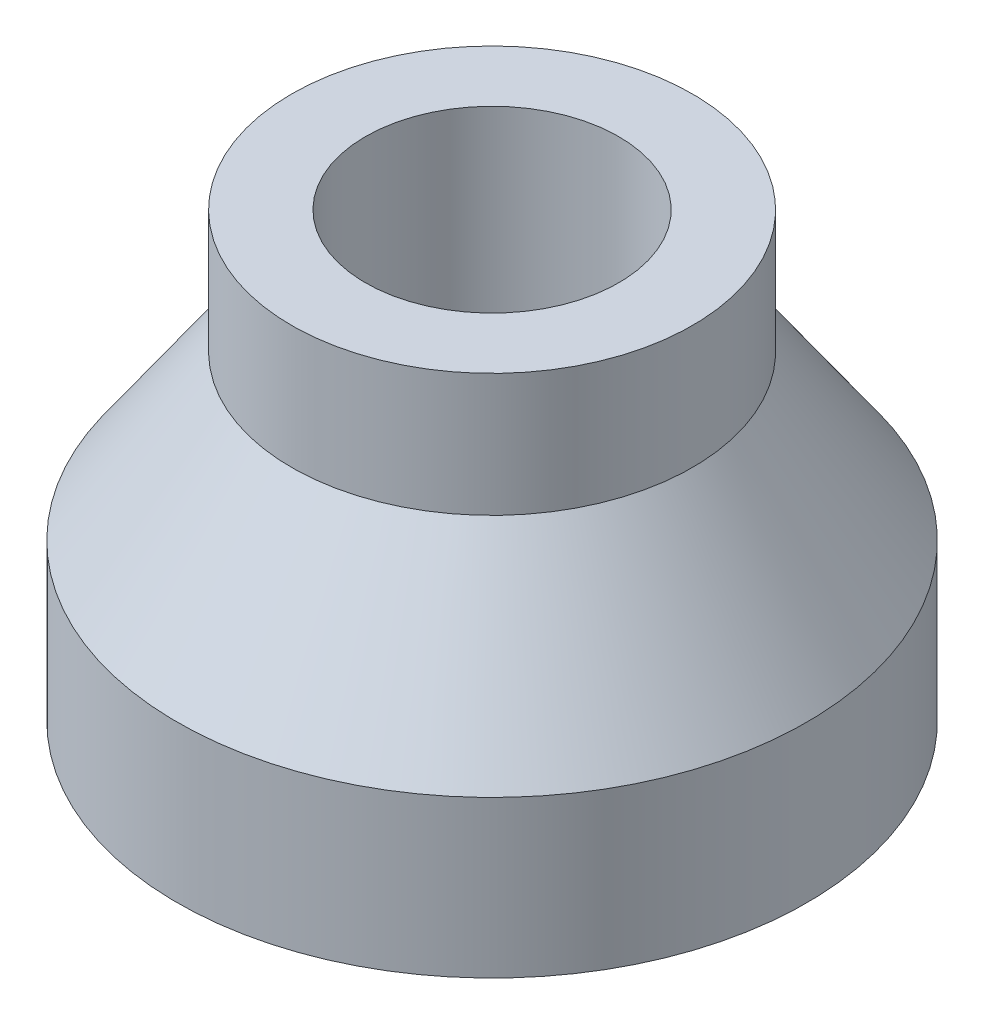
from build123d import *


with BuildPart() as part:
    # 草图1 → 旋转1 (revolve)
    with BuildSketch(Plane.XY):
        Polygon((-12.575, -21.009790145), (-14.075, -21.009790145), (-14.075, -23.509790145), (-16.4, -26.830234261), (-16.4, -30.009790145), (-14.4, -30.009790145), (-14.4, -27.460831839), (-12.575, -24.854461726), align=None)
    revolve(axis=Axis((-10, -0.125632633, 0), (0, -1, 0)))


solid = part.part
